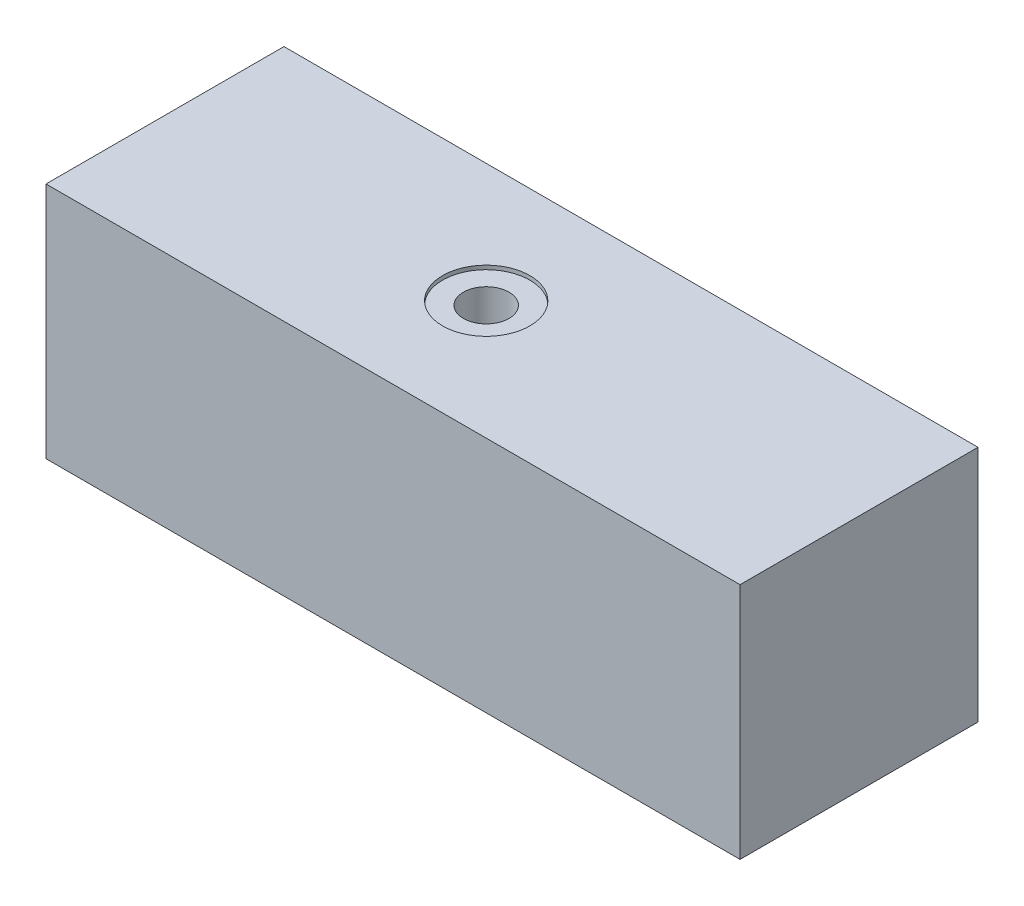
from build123d import *

# Parameters (mm, degrees)
ESQUISSE1_W          = 175
ESQUISSE1_H          = 60
EXTRUSION1_DEPTH     = 60
PER_AGE1_D           = 11.5
PER_AGE1_CBORE_D     = 22
PER_AGE1_CBORE_DEPTH = 1


with BuildPart() as part:
    # Esquisse1 → Extrusion1 (new body)
    with BuildSketch(Plane.XY):
        with Locations((0, 4)):
            Rectangle(ESQUISSE1_W, ESQUISSE1_H)
    extrude(amount=EXTRUSION1_DEPTH)

    # Perçage1 (through all)
    with Locations(Plane(origin=(-6.5, 34, 30), x_dir=(1, 0, 0), z_dir=(0, 1, 0))):
        with Locations((0, 0)):
            CounterBoreHole(PER_AGE1_D / 2, PER_AGE1_CBORE_D / 2, PER_AGE1_CBORE_DEPTH)


solid = part.part
